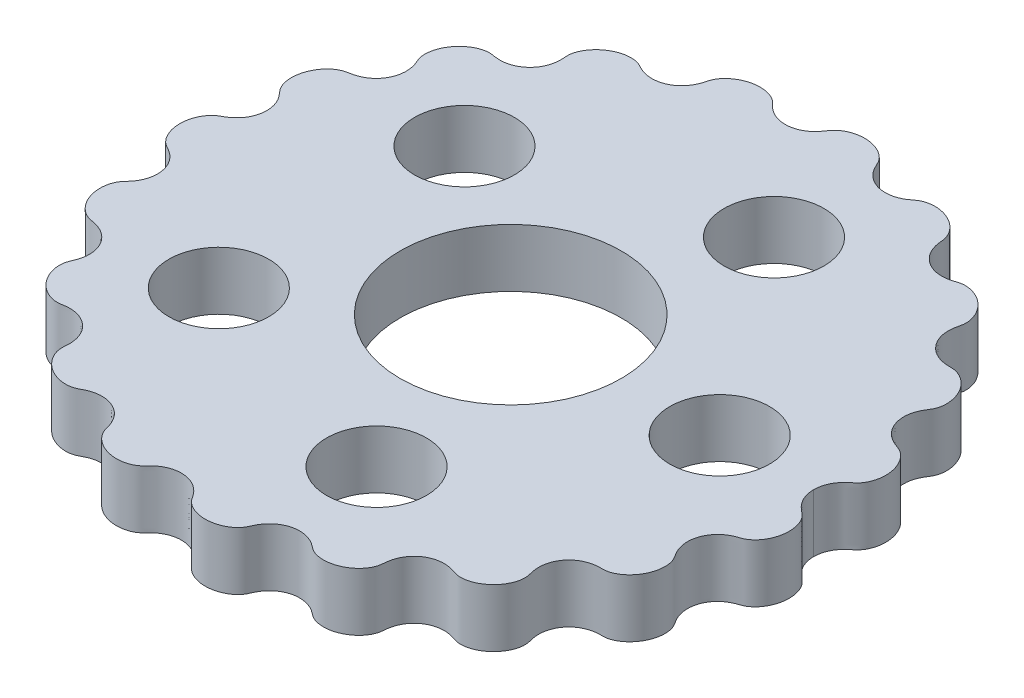
from build123d import *

# Parameters (mm, degrees)
BOSS_EXTRUDE1_START = 0.5
SKETCH1_R           = 9.525
SKETCH1_R_2         = 4.3
BOSS_EXTRUDE1_DEPTH = 5


with BuildPart() as part:
    # Sketch1 → Boss-Extrude1 (new body)
    with BuildSketch(Plane(origin=(0, 0, 0), x_dir=(1, 0, 0), z_dir=(0, 1, 0)).offset(BOSS_EXTRUDE1_START)):
        with BuildLine():
            add(Edge.make_bspline(
                [(26.1, 0), (26.1, -0.037654823), (26.101959838, -0.112657778), (26.110778914, -0.269126865), (26.134236474, -0.431457932), (26.169271902, -0.604227737), (26.215706934, -0.771665888), (26.273295099, -0.936077152), (26.341753554, -1.096140667), (26.427915849, -1.265624131), (26.534785055, -1.441856171), (26.699683698, -1.67031679), (26.901439537, -1.88987584), (27.124804261, -2.086960491), (27.362808407, -2.265185488), (27.541686596, -2.422902757), (27.696832367, -2.612532966), (27.831038283, -2.823925745), (27.942707414, -3.055157968), (28.032027129, -3.302051278), (28.11328707, -3.620150325), (28.164200716, -4.011385863), (28.158229712, -4.465911271), (28.068723695, -4.971978987), (27.92239684, -5.391891507), (27.752179238, -5.726439419), (27.579155333, -5.986088777), (27.422588116, -6.181127718), (27.208663224, -6.396612626), (26.970426874, -6.581500429), (26.704262293, -6.714420074), (26.426139511, -6.802056051), (26.208386955, -6.88526241), (25.996005013, -6.981754411), (25.792352168, -7.095680473), (25.506454673, -7.288419365), (25.166810015, -7.595932092), (24.823327666, -8.065640834), (24.573113299, -8.722842261), (24.513192386, -9.374110704), (24.595878356, -9.908866565), (24.732910005, -10.306165942), (24.863450157, -10.578322253), (24.983619743, -10.787813544), (25.118076955, -10.987994036), (25.243899654, -11.194436481), (25.335973848, -11.425133948), (25.399465388, -11.670686177), (25.434320143, -11.928228009), (25.441972482, -12.193681648), (25.418791023, -12.524941115), (25.342360013, -12.916594687), (25.19123207, -13.347764303), (24.944934541, -13.798710217), (24.636097611, -14.197365909), (24.319379046, -14.49299579), (24.014552178, -14.704170688), (23.744181637, -14.84409763), (23.521984724, -14.930759504), (23.295178333, -14.99089675), (23.066212192, -15.018050457), (22.836177533, -15.015427607), (22.606453619, -15.01876633), (22.377139997, -15.037432831), (22.149964765, -15.073477643), (21.901722715, -15.134262004), (21.636405279, -15.227464361), (21.285248205, -15.397408544), (20.867012031, -15.696199645), (20.457707614, -16.15442787), (20.167634198, -16.744097483), (20.040652676, -17.344074218), (20.044251146, -17.837567352), (20.101291606, -18.208300972), (20.178290252, -18.510160997), (20.237387065, -18.752911084), (20.25416585, -19.007094176), (20.236737196, -19.264546648), (20.175345508, -19.587685891), (20.045401481, -19.966212229), (19.825733648, -20.379092954), (19.503349147, -20.792215121), (19.125691797, -21.140607349), (18.706122195, -21.419205006), (18.312603134, -21.597813456), (17.957291469, -21.7007495), (17.659059082, -21.747208145), (17.425046357, -21.759337106), (17.196962801, -21.74598206), (16.978070968, -21.704489959), (16.76754266, -21.633081261), (16.557577444, -21.561231407), (16.343192491, -21.502693833), (16.125264662, -21.459296016), (15.796467784, -21.420434357), (15.354937395, -21.427964236), (14.788969175, -21.550301969), (14.154555419, -21.88057341), (13.666183716, -22.345893253), (13.336362648, -22.88226304), (13.173492135, -23.353715627), (13.104616127, -23.716957195), (13.076673275, -24.02279806), (13.057814188, -24.268242303), (12.998712205, -24.514111874), (12.903235055, -24.754151925), (12.744151813, -25.045309117), (12.499019901, -25.369043134), (12.15565715, -25.696338346), (11.704870213, -25.994619846), (11.211604108, -26.212225806), (10.68997676, -26.343697667), (10.221282681, -26.37756552), (9.820613034, -26.342575187), (9.498973157, -26.26665957), (9.255580912, -26.177092448), (9.029799659, -26.05655854), (8.831572762, -25.902571784), (8.58391576, -25.71111477), (8.26446612, -25.51104552), (7.810081455, -25.312340621), (7.205513819, -25.192791232), (6.550224923, -25.228730886), (5.971337018, -25.424349477), (5.536862389, -25.687803773), (5.245653306, -25.938729612), (5.05538626, -26.143844122), (4.899938261, -26.348212338), (4.774598737, -26.545523005), (4.66455004, -26.751857795), (4.569043475, -26.964881996), (4.476314366, -27.179586841), (4.35349979, -27.379281189), (4.203299855, -27.561863118), (4.032131291, -27.727950003), (3.79525899, -27.914521158), (3.482483913, -28.102825699), (3.089596664, -28.268830385), (2.604961188, -28.388334129), (2.095437225, -28.431200093), (1.573536083, -28.390048007), (1.119470452, -28.272805038), (0.751616161, -28.112409401), (0.472786699, -27.939857046), (0.273494126, -27.780889901), (0.100220003, -27.601224467), (-0.036900458, -27.400701128), (-0.167623209, -27.196704665), (-0.313051844, -27.002366981), (-0.512485215, -26.773835259), (-0.825221581, -26.489940267), (-1.286824514, -26.202366803), (-1.906524561, -26.003420899), (-2.599411552, -25.975353149), (-3.156761697, -26.100953574), (-3.565273796, -26.283242121), (-3.85343043, -26.463789354), (-4.040862241, -26.604608953), (-4.216144571, -26.760241463), (-4.380398314, -26.92724911), (-4.535647832, -27.102695562), (-4.708038901, -27.262129389), (-4.906562373, -27.395532872), (-5.122340191, -27.506639083), (-5.353111082, -27.594765527), (-5.595122062, -27.660809079), (-5.904112165, -27.714960076), (-6.280362612, -27.736643211), (-6.724192808, -27.701413516), (-7.222479814, -27.579956195), (-7.639241179, -27.403463388), (-7.974539319, -27.20159547), (-8.231562236, -27.001455404), (-8.420763279, -26.822438839), (-8.588375147, -26.628010193), (-8.729951421, -26.419225268), (-8.843841456, -26.197883212), (-8.918149442, -25.965106023), (-8.973095058, -25.727696563), (-9.043925473, -25.494305036), (-9.153099618, -25.209622768), (-9.306801806, -24.915867583), (-9.513499076, -24.623747572), (-9.839816185, -24.284860522), (-10.264400599, -23.977825959), (-10.829665695, -23.73805203), (-11.410498796, -23.660908882), (-11.876291721, -23.69638221), (-12.218754959, -23.773476834), (-12.444677349, -23.845131331), (-12.663781479, -23.935334112), (-12.876076729, -24.040286172), (-13.082031425, -24.157155246), (-13.298581127, -24.254322867), (-13.533913594, -24.317810826), (-13.780466915, -24.35378875), (-14.035834908, -24.361637388), (-14.29640587, -24.343065665), (-14.618522573, -24.288656576), (-14.994949776, -24.177456101), (-15.408578969, -23.98833338), (-15.837205258, -23.700628449), (-16.164907311, -23.393911293), (-16.404344734, -23.097848292), (-16.573318675, -22.829755719), (-16.687662049, -22.603571121), (-16.776686853, -22.372337621), (-16.837746076, -22.138542446), (-16.870186158, -21.9045043), (-16.866368416, -21.674536104), (-16.843233106, -21.446228653), (-16.832615307, -21.216921003), (-16.837266827, -20.987328792), (-16.860312683, -20.758768834), (-16.923293404, -20.419212422), (-17.071833991, -19.980587652), (-17.369040524, -19.477210915), (-17.874882375, -18.988476541), (-18.447970133, -18.67719025), (-19.027548134, -18.525710765), (-19.510111737, -18.503831617), (-19.87664814, -18.538267665), (-20.177623885, -18.593432706), (-20.421371941, -18.622411671), (-20.671244853, -18.609095567), (-20.920859775, -18.564988583), (-21.167935078, -18.490627654), (-21.4095885, -18.389962143), (-21.698210119, -18.235368531), (-22.02014446, -18.009296139), (-22.350982927, -17.698329853), (-22.663749807, -17.29065213), (-22.904833826, -16.843369276), (-23.047778377, -16.427343965), (-23.116267898, -16.057121475), (-23.13204139, -15.75076918), (-23.118687314, -15.513701439), (-23.079662446, -15.285779121), (-23.010740762, -15.071995011), (-22.917965638, -14.867945737), (-22.831783511, -14.661241535), (-22.759010838, -14.449176582), (-22.702274861, -14.232285466), (-22.657962992, -13.982307736), (-22.635886805, -13.699380389), (-22.650675118, -13.300053937), (-22.761871082, -12.783822482), (-23.029318637, -12.21492364), (-23.467562019, -11.712001704), (-23.923403017, -11.398122255), (-24.315464063, -11.222988994), (-24.609412242, -11.131419108), (-24.849484665, -11.076013531), (-25.092573069, -11.038656205), (-25.334505588, -10.990769991), (-25.569274268, -10.900544213), (-25.793687584, -10.779741828), (-26.005954771, -10.630692764), (-26.204437626, -10.457777096), (-26.43033221, -10.218351564), (-26.664824109, -9.899800806), (-26.878975385, -9.499593675), (-27.044436206, -9.01574461), (-27.129961923, -8.520121003), (-27.134474175, -8.0871314), (-27.084857153, -7.719810764), (-27.006013082, -7.425910719), (-26.920443462, -7.203342298), (-26.812236107, -6.99521479), (-26.678616217, -6.807274427), (-26.521312285, -6.639361313), (-26.367637466, -6.468593342), (-26.225484226, -6.287683037), (-26.097389187, -6.096643611), (-25.974680445, -5.876177314), (-25.864713462, -5.624531597), (-25.752433682, -5.264729725), (-25.681810262, -4.762581394), (-25.73099742, -4.146949182), (-25.961949286, -3.524047609), (-26.321265325, -3.010597952), (-26.690239718, -2.672986455), (-27.000992368, -2.462677557), (-27.274877294, -2.314024503), (-27.49416336, -2.194208061), (-27.693761753, -2.035785351), (-27.872384261, -1.849426066), (-28.029881682, -1.639477669), (-28.165833209, -1.41056993), (-28.278417606, -1.169112764), (-28.356850629, -0.949924532), (-28.409926509, -0.757383066), (-28.444786226, -0.594531067), (-28.467072671, -0.464613598), (-28.483773852, -0.334062838), (-28.494901549, -0.194206271), (-28.499073007, -0.086237954), (-28.5, -0.028769446), (-28.5, 0)],
                knots=[0.065357727, 0.065357727, 0.065357727, 0.065357727, 0.065357727, 0.066838802, 0.068319877, 0.069800952, 0.071282027, 0.072763102, 0.074244177, 0.075725252, 0.077206327, 0.079230954, 0.081255581, 0.085304836, 0.087329463, 0.08935409, 0.091378717, 0.093403344, 0.095635344, 0.097867345, 0.100099346, 0.102331347, 0.106795348, 0.11125935, 0.115505731, 0.119752112, 0.121875303, 0.123998494, 0.126121685, 0.128244875, 0.132212277, 0.134195978, 0.136179679, 0.13816338, 0.140147081, 0.142130782, 0.144114483, 0.149889299, 0.155664115, 0.161716618, 0.167769121, 0.171875721, 0.17392902, 0.17598232, 0.17803562, 0.18008892, 0.182142219, 0.184195519, 0.186452911, 0.188710303, 0.190967695, 0.193225087, 0.197739871, 0.202254655, 0.206449673, 0.210644692, 0.21483971, 0.216937219, 0.219034728, 0.220990732, 0.222946736, 0.22490274, 0.226858744, 0.228814748, 0.230770752, 0.232726756, 0.23468276, 0.237505487, 0.240328214, 0.245973668, 0.25207373, 0.258173791, 0.262418319, 0.266662848, 0.268785112, 0.270907376, 0.27302964, 0.275151904, 0.277414155, 0.279676405, 0.284200907, 0.288725408, 0.29324991, 0.297434601, 0.301619291, 0.305803982, 0.307896327, 0.309988673, 0.311878349, 0.313768025, 0.315657701, 0.317547377, 0.319437053, 0.32132673, 0.323216406, 0.325106082, 0.330697764, 0.336289446, 0.3427217, 0.349153953, 0.353337838, 0.357521724, 0.359613666, 0.361705609, 0.363797552, 0.365889495, 0.368183967, 0.37047844, 0.375067386, 0.379656332, 0.384245278, 0.388791482, 0.393337686, 0.39788389, 0.400156991, 0.402430093, 0.404562559, 0.406695025, 0.408827491, 0.410959957, 0.415224889, 0.419489821, 0.425619329, 0.431748836, 0.43728204, 0.440048642, 0.442815244, 0.444803142, 0.446791041, 0.44877894, 0.450766838, 0.452754737, 0.454742636, 0.456730534, 0.458718433, 0.460783687, 0.462848941, 0.466979449, 0.471109956, 0.475240464, 0.479777245, 0.484314026, 0.488850807, 0.491119197, 0.493387587, 0.495450918, 0.497514249, 0.499577579, 0.50164091, 0.503704241, 0.505767572, 0.509894233, 0.515977148, 0.522060063, 0.527644163, 0.533228263, 0.535221378, 0.537214493, 0.539207608, 0.541200724, 0.543193839, 0.545186954, 0.54718007, 0.549173185, 0.551305995, 0.553438805, 0.555571614, 0.557704424, 0.561970044, 0.566235664, 0.570664673, 0.575093682, 0.577308187, 0.579522691, 0.581737196, 0.583951701, 0.586025843, 0.588099985, 0.590174127, 0.592248269, 0.594322411, 0.596396553, 0.600544837, 0.603500405, 0.606455973, 0.612367108, 0.61826056, 0.624154012, 0.626168793, 0.628183573, 0.630198354, 0.632213134, 0.634227915, 0.636242695, 0.638257476, 0.640272256, 0.642493095, 0.644713933, 0.646934771, 0.64915561, 0.653597287, 0.658038963, 0.662348161, 0.666657359, 0.668811958, 0.670966557, 0.673121156, 0.675275756, 0.677228627, 0.679181499, 0.681134371, 0.683087243, 0.685040114, 0.686992986, 0.688945858, 0.69089873, 0.696785964, 0.702673198, 0.708614477, 0.714555757, 0.718723943, 0.722892129, 0.724976222, 0.727060315, 0.729144408, 0.7312285, 0.733454223, 0.735679945, 0.737905667, 0.740131389, 0.744582833, 0.749034278, 0.753292913, 0.757551548, 0.761810184, 0.763939501, 0.766068819, 0.767975191, 0.769881564, 0.771787936, 0.773694308, 0.77560068, 0.777507052, 0.779413425, 0.781319797, 0.784235185, 0.787150573, 0.792981348, 0.799176944, 0.80537254, 0.809561259, 0.811655619, 0.813749979, 0.815844338, 0.817938698, 0.820033058, 0.822127418, 0.82436519, 0.826602962, 0.828840734, 0.831078507, 0.835554051, 0.840029596, 0.844222519, 0.848415442, 0.852608365, 0.854704826, 0.856801288, 0.858757317, 0.860713346, 0.862669375, 0.864625404, 0.866581433, 0.868537462, 0.870493491, 0.872449521, 0.875160805, 0.87787209, 0.883294658, 0.889615361, 0.895936064, 0.900181909, 0.904427753, 0.906550675, 0.908673598, 0.91079652, 0.912919442, 0.915182616, 0.91744579, 0.919708964, 0.921972138, 0.924235312, 0.925366899, 0.926498486, 0.927630073, 0.92876166, 0.929893247, 0.931024834, 0.931024834, 0.931024834, 0.931024834, 0.931024834], degree=4))
            add(Edge.make_bspline(
                [(26.1, 0), (26.1, 0.037557605), (26.101960171, 0.11236891), (26.11078076, 0.268515148), (26.134241319, 0.430312774), (26.169279566, 0.602699324), (26.215712535, 0.769655848), (26.273296837, 0.933610032), (26.341723749, 1.093214642), (26.427887255, 1.262171064), (26.534631095, 1.437956629), (26.66472128, 1.617457312), (26.820221457, 1.797178197), (26.990110154, 1.963295025), (27.170908295, 2.117246114), (27.359583137, 2.261393394), (27.534725755, 2.422495239), (27.68734562, 2.613319468), (27.819402465, 2.825437942), (27.929409737, 3.056775069), (28.017350198, 3.303529964), (28.097313972, 3.621173349), (28.14718039, 4.011594981), (28.140708419, 4.466301535), (28.050717291, 4.97349364), (27.882896183, 5.454979192), (27.671504474, 5.84304381), (27.44357466, 6.144857491), (27.22674656, 6.364817608), (27.040892977, 6.516562131), (26.843642223, 6.643249286), (26.635913668, 6.738215402), (26.419935905, 6.811078154), (26.206939902, 6.891943154), (25.999467088, 6.986584145), (25.799911288, 7.096971584), (25.514583784, 7.286926668), (25.171992168, 7.593045832), (24.825107804, 8.063163705), (24.5729884, 8.722990296), (24.513513946, 9.375105338), (24.596667177, 9.908457378), (24.733854448, 10.304635683), (24.864153794, 10.576176989), (24.983841337, 10.785268449), (25.116626146, 10.985976921), (25.23781854, 11.19454866), (25.326672131, 11.425792091), (25.387836906, 11.671325816), (25.420923382, 11.928463132), (25.427271397, 12.193315351), (25.402925967, 12.523691904), (25.325735565, 12.914209417), (25.174039331, 13.345327688), (24.926907331, 13.797258339), (24.616364755, 14.197845718), (24.29698117, 14.495520078), (23.989587623, 14.708050701), (23.718534775, 14.847912779), (23.49790773, 14.934027895), (23.274665325, 14.993741496), (23.051299597, 15.022739648), (22.826527034, 15.023767999), (22.602061074, 15.027768326), (22.378022274, 15.045955422), (22.15589886, 15.080417823), (21.828556405, 15.158511555), (21.409282012, 15.322259794), (20.924725716, 15.635210395), (20.456823885, 16.15782959), (20.166872697, 16.748469446), (20.041025764, 17.347126751), (20.045267093, 17.839438353), (20.102257891, 18.209228311), (20.177807446, 18.510727553), (20.231772918, 18.754068221), (20.244874723, 19.007789076), (20.225231154, 19.26440437), (20.174580683, 19.52116384), (20.09617018, 19.774796717), (19.967529458, 20.0808296), (19.769244222, 20.426950741), (19.48836858, 20.785956984), (19.112265891, 21.132969663), (18.695113942, 21.411025316), (18.304377275, 21.589914677), (17.951596369, 21.694385138), (17.597097582, 21.752232251), (17.302747889, 21.761285903), (17.01353957, 21.72416988), (16.741890871, 21.635235734), (16.525460698, 21.563366751), (16.30449365, 21.505143995), (16.079996624, 21.463086124), (15.830837481, 21.437177305), (15.558265867, 21.434810852), (15.186128323, 21.472203392), (14.696111953, 21.603682941), (14.145806732, 21.892344423), (13.663352315, 22.3528318), (13.335089923, 22.888301692), (13.173326778, 23.358816985), (13.10466991, 23.721205101), (13.075926055, 24.02625008), (13.052488399, 24.270732841), (12.989529913, 24.51498191), (12.892121578, 24.75348234), (12.73129963, 25.042745905), (12.48537644, 25.364486059), (12.14194144, 25.689934199), (11.690895191, 25.987555412), (11.196405878, 26.205372018), (10.672319964, 26.337289188), (10.200295403, 26.371119582), (9.79682711, 26.335572462), (9.474750205, 26.259329406), (9.232977676, 26.17056519), (9.009974637, 26.052913705), (8.813709595, 25.905471503), (8.570429252, 25.719531022), (8.258164128, 25.523707411), (7.809364316, 25.324975745), (7.207254198, 25.202018598), (6.546067121, 25.235297975), (5.877241902, 25.46217649), (5.398588959, 25.786008977), (5.084963573, 26.105496235), (4.885275351, 26.374184304), (4.766566725, 26.56369587), (4.661655149, 26.761176326), (4.569316509, 26.964531297), (4.477345935, 27.168404949), (4.359380537, 27.358962352), (4.214368301, 27.53730225), (4.04657292, 27.702735184), (3.809779019, 27.892470211), (3.492450279, 28.086181237), (3.093047806, 28.256870656), (2.602432058, 28.378851651), (2.089146834, 28.422578188), (1.565967934, 28.381961626), (1.112700174, 28.266239985), (0.745063975, 28.107841233), (0.465765003, 27.937570102), (0.265546245, 27.780769343), (0.090316159, 27.603947454), (-0.050614273, 27.406772328), (-0.182236215, 27.203960446), (-0.32748241, 27.01023592), (-0.526391485, 26.782147944), (-0.838010778, 26.498557331), (-1.298111394, 26.211094086), (-1.918402994, 26.011412018), (-2.614461149, 25.984022917), (-3.173523862, 26.112524982), (-3.581992111, 26.29793532), (-3.867307934, 26.479069847), (-4.049922769, 26.617384469), (-4.221152863, 26.769533189), (-4.381916757, 26.932432711), (-4.535916963, 27.101844858), (-4.706349347, 27.255419887), (-4.902143243, 27.386349656), (-5.116496624, 27.496610446), (-5.347239404, 27.585081759), (-5.591110656, 27.651879702), (-5.902424379, 27.706740788), (-6.281662868, 27.728850923), (-6.729961118, 27.693395981), (-7.234342379, 27.570243689), (-7.65633568, 27.39048211), (-7.996662398, 27.184271517), (-8.256329457, 26.979520574), (-8.448308601, 26.796657484), (-8.651059963, 26.555390104), (-8.81700112, 26.293818775), (-8.913447768, 26.039171491), (-8.970105978, 25.812426923), (-9.032713325, 25.58729032), (-9.125707716, 25.309967392), (-9.315929764, 24.909990901), (-9.674728567, 24.436130369), (-10.183459835, 24.025846061), (-10.836211591, 23.747068892), (-11.420435291, 23.669904101), (-11.88504253, 23.705810937), (-12.226667293, 23.78306041), (-12.452036547, 23.854757814), (-12.670772627, 23.944623883), (-12.882685423, 24.04910601), (-13.089636758, 24.163269032), (-13.307649025, 24.25586997), (-13.543038731, 24.316628716), (-13.789378657, 24.350416644), (-14.044170323, 24.356729239), (-14.304069866, 24.336979732), (-14.625232978, 24.28158743), (-15.000545755, 24.169770966), (-15.412965418, 23.980630522), (-15.840661536, 23.693607689), (-16.214284288, 23.344751587), (-16.484954149, 22.992579821), (-16.66924689, 22.660103051), (-16.782520625, 22.371064468), (-16.845505846, 22.138296706), (-16.880496111, 21.905251417), (-16.881316199, 21.675736003), (-16.860821292, 21.447623517), (-16.850555776, 21.218839449), (-16.855364031, 20.989715925), (-16.878196474, 20.761647471), (-16.940732923, 20.422799562), (-17.08843954, 19.985128723), (-17.385800937, 19.480651112), (-17.894498222, 18.99046133), (-18.469877881, 18.681086595), (-18.990372753, 18.548665966), (-19.406487185, 18.518804425), (-19.705993797, 18.531117789), (-19.944219194, 18.557992617), (-20.18020116, 18.599236489), (-20.419074353, 18.623629916), (-20.665189551, 18.609868388), (-20.913081212, 18.565696025), (-21.160188551, 18.49160002), (-21.403579002, 18.390348128), (-21.694263355, 18.234921696), (-22.018523547, 18.007449916), (-22.351791039, 17.694414257), (-22.666813538, 17.283805034), (-22.909544257, 16.833152952), (-23.05328345, 16.413896067), (-23.121977202, 16.040814849), (-23.137486808, 15.73333485), (-23.124191467, 15.496830586), (-23.085834476, 15.27070552), (-23.019759809, 15.059270031), (-22.930938393, 14.856805801), (-22.846986577, 14.652472592), (-22.775838439, 14.443088067), (-22.720106096, 14.229079512), (-22.661167611, 13.897241052), (-22.644448196, 13.442707496), (-22.741948127, 12.865327357), (-23.045635909, 12.219196868), (-23.44242448, 11.764680971), (-23.836324638, 11.475330273), (-24.161017984, 11.306249651), (-24.388411485, 11.212728737), (-24.623075892, 11.13984931), (-24.862494236, 11.084293926), (-25.104833104, 11.045464819), (-25.345143534, 10.99258107), (-25.578096716, 10.899626693), (-25.800907749, 10.777130543), (-26.011679105, 10.6270765), (-26.208845565, 10.453618678), (-26.433311015, 10.213944036), (-26.666458308, 9.895605218), (-26.879612895, 9.496087063), (-27.044681042, 9.013360245), (-27.130595174, 8.518940818), (-27.1361498, 8.086925061), (-27.088099036, 7.720199825), (-27.011063532, 7.426513435), (-26.927412142, 7.203721198), (-26.82146914, 6.995052926), (-26.691353099, 6.805240005), (-26.537235644, 6.635002809), (-26.384390326, 6.464109969), (-26.24276044, 6.28338013), (-26.114855809, 6.092759785), (-25.992262139, 5.872830792), (-25.882318571, 5.621822442), (-25.770018774, 5.262920475), (-25.698994495, 4.759665907), (-25.749262159, 4.140759285), (-25.983377251, 3.517989478), (-26.34496785, 3.008162522), (-26.711826659, 2.675630856), (-27.015956615, 2.470138444), (-27.283130805, 2.323166563), (-27.495697151, 2.202427731), (-27.691533018, 2.045315012), (-27.868698672, 1.860041494), (-28.02624223, 1.650179776), (-28.163215016, 1.419802986), (-28.276658401, 1.176817039), (-28.355709734, 0.956173448), (-28.409204863, 0.762425721), (-28.444342965, 0.598457075), (-28.466807893, 0.467595466), (-28.4836432, 0.33633456), (-28.494860457, 0.195831201), (-28.499065537, 0.086806089), (-28.5, 0.028958742), (-28.5, 0)],
                knots=[0.065428509, 0.065428509, 0.065428509, 0.065428509, 0.065428509, 0.066909165, 0.06838982, 0.069870476, 0.071351132, 0.072831787, 0.074312443, 0.075793099, 0.077273754, 0.079298617, 0.08132348, 0.083348342, 0.085373205, 0.087398068, 0.089422931, 0.091447793, 0.093472656, 0.095704556, 0.097936456, 0.100168356, 0.102400256, 0.106864056, 0.111327856, 0.11561548, 0.119903104, 0.124190727, 0.126334539, 0.128478351, 0.130421745, 0.13236514, 0.134308534, 0.136251928, 0.138195322, 0.140138717, 0.142082111, 0.144025505, 0.149879071, 0.155732636, 0.161783086, 0.167833536, 0.171940286, 0.17399366, 0.176047035, 0.17810041, 0.180153784, 0.182207159, 0.184260534, 0.186517645, 0.188774756, 0.191031868, 0.193288979, 0.197803202, 0.202317424, 0.206554339, 0.210791254, 0.215028169, 0.217146627, 0.219265085, 0.22118072, 0.223096355, 0.22501199, 0.226927625, 0.22884326, 0.230758895, 0.23267453, 0.234590165, 0.240315033, 0.246039902, 0.252137777, 0.258235653, 0.262479911, 0.266724169, 0.268846298, 0.270968427, 0.273090556, 0.275212686, 0.277474466, 0.279736246, 0.281998027, 0.284259807, 0.288783368, 0.293306929, 0.297478465, 0.30165, 0.305821535, 0.307907303, 0.309993071, 0.313886946, 0.315833883, 0.31778082, 0.319727758, 0.321674695, 0.323621633, 0.32556857, 0.328264738, 0.330960906, 0.336353242, 0.34278217, 0.349211099, 0.353394823, 0.357578547, 0.359670409, 0.361762271, 0.363854133, 0.365945995, 0.3682398, 0.370533604, 0.375121214, 0.379708823, 0.384296433, 0.388884931, 0.393473428, 0.398061926, 0.400356175, 0.402650424, 0.404740985, 0.406831546, 0.408922108, 0.411012669, 0.415193791, 0.419374914, 0.425582296, 0.431789679, 0.437483986, 0.443178293, 0.445084123, 0.446989952, 0.448895782, 0.450801611, 0.452707441, 0.45461327, 0.4565191, 0.458424929, 0.460532562, 0.462640195, 0.46685546, 0.471070725, 0.47528599, 0.479822206, 0.484358421, 0.488894637, 0.491162745, 0.493430852, 0.495494138, 0.497557424, 0.49962071, 0.501683995, 0.503747281, 0.505810567, 0.509937139, 0.516017911, 0.522098683, 0.52776142, 0.533424156, 0.535376276, 0.537328396, 0.539280516, 0.541232636, 0.543184755, 0.545136875, 0.547088995, 0.549041115, 0.551195406, 0.553349697, 0.555503988, 0.557658279, 0.561966861, 0.566275442, 0.57078566, 0.575295877, 0.577550985, 0.579806094, 0.582061202, 0.584316311, 0.588303705, 0.590297402, 0.591294251, 0.592291099, 0.596278494, 0.600265888, 0.606334723, 0.612403558, 0.6182954, 0.624187243, 0.626202375, 0.628217508, 0.63023264, 0.632247772, 0.634262905, 0.636278037, 0.638293169, 0.640308302, 0.642529051, 0.6447498, 0.64697055, 0.649191299, 0.653632797, 0.658074296, 0.66238357, 0.666692845, 0.67100212, 0.673156757, 0.675311394, 0.677264526, 0.679217658, 0.68117079, 0.683123922, 0.685077055, 0.687030187, 0.688983319, 0.690936451, 0.69682189, 0.702707329, 0.708727249, 0.714747169, 0.718834421, 0.720878047, 0.722921673, 0.724965299, 0.727008925, 0.729052551, 0.731096177, 0.733342138, 0.735588098, 0.737834058, 0.740080019, 0.744571939, 0.74906386, 0.753364202, 0.757664545, 0.761964887, 0.764115058, 0.766265229, 0.768149956, 0.770034683, 0.771919409, 0.773804136, 0.775688862, 0.777573589, 0.779458316, 0.781343042, 0.787178143, 0.793013244, 0.799206318, 0.805399393, 0.807493698, 0.809588002, 0.811682307, 0.813776612, 0.815870916, 0.817965221, 0.820059526, 0.82215383, 0.82439128, 0.826628731, 0.828866181, 0.831103631, 0.835578532, 0.840053432, 0.844246889, 0.848440346, 0.852633803, 0.854730531, 0.856827259, 0.858783839, 0.860740418, 0.862696998, 0.864653577, 0.866610157, 0.868566736, 0.870523316, 0.872479895, 0.875190971, 0.877902047, 0.883324198, 0.88972267, 0.896121142, 0.90028496, 0.904448778, 0.906530687, 0.908612596, 0.910694505, 0.912776414, 0.915059729, 0.917343045, 0.91962636, 0.921909675, 0.924192991, 0.925334648, 0.926476306, 0.927617964, 0.928759621, 0.929901279, 0.931042936, 0.931042936, 0.931042936, 0.931042936, 0.931042936], degree=4))
        make_face()
        with Locations(Location((0, 0, 0), (0, 0, 270))):
            Circle(SKETCH1_R, mode=Mode.SUBTRACT)
        with Locations(Location((18, 0, 0), (0, 0, 270))):
            Circle(SKETCH1_R_2, mode=Mode.SUBTRACT)
        with Locations(Location((5.562305899, -17.119017293, 0), (0, 0, 270))):
            Circle(SKETCH1_R_2, mode=Mode.SUBTRACT)
        with Locations(Location((-14.562305899, -10.580134541, 0), (0, 0, 270))):
            Circle(SKETCH1_R_2, mode=Mode.SUBTRACT)
        with Locations(Location((-14.562305899, 10.580134541, 0), (0, 0, 270))):
            Circle(SKETCH1_R_2, mode=Mode.SUBTRACT)
        with Locations(Location((5.562305899, 17.119017293, 0), (0, 0, 270))):
            Circle(SKETCH1_R_2, mode=Mode.SUBTRACT)
    extrude(amount=BOSS_EXTRUDE1_DEPTH)


solid = part.part
